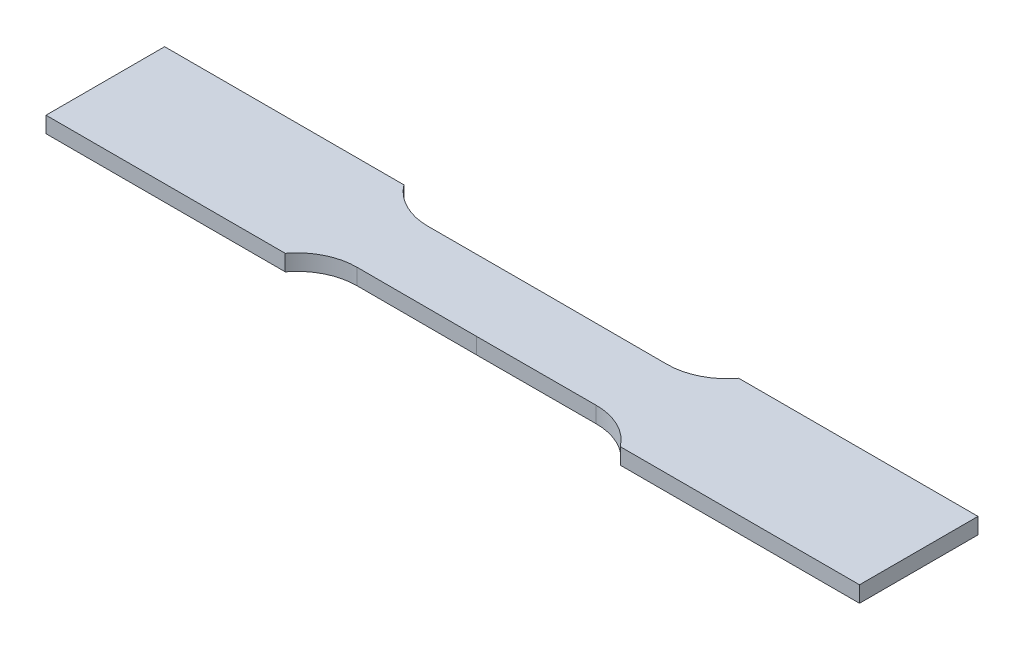
from build123d import *

# Parameters (mm, degrees)
BOSS_EXTRUDE2_DEPTH = 3.357


with BuildPart() as part:
    # Sketch1 → Boss-Extrude2 (new body)
    with BuildSketch(Plane(origin=(0, 0, 0), x_dir=(1, 0, 0), z_dir=(0, 1, 0))):
        with BuildLine():
            Line((35, 12.381710977), (85, 12.381710977))
            Line((85, 12.381710977), (85, -12.381710977))
            Line((85, -12.381710977), (35, -12.381710977))
            ThreePointArc((35, -12.381710977), (30.586810484, -8.714242442), (25, -7.405))
            Line((25, -7.405), (0, -7.44))
            Line((0, -7.44), (-25, -7.415))
            ThreePointArc((-25, -7.415), (-30.587768191, -8.727215395), (-35, -12.398355963))
            Line((-35, -12.398355963), (-85, -12.398355963))
            Line((-85, -12.398355963), (-85, 12.398355963))
            Line((-85, 12.398355963), (-35, 12.398355963))
            ThreePointArc((-35, 12.398355963), (-30.587768191, 8.727215395), (-25, 7.415))
            Line((-25, 7.415), (0, 7.44))
            Line((0, 7.44), (25, 7.405))
            ThreePointArc((25, 7.405), (30.586810484, 8.714242442), (35, 12.381710977))
        make_face()
    extrude(amount=BOSS_EXTRUDE2_DEPTH)


solid = part.part
